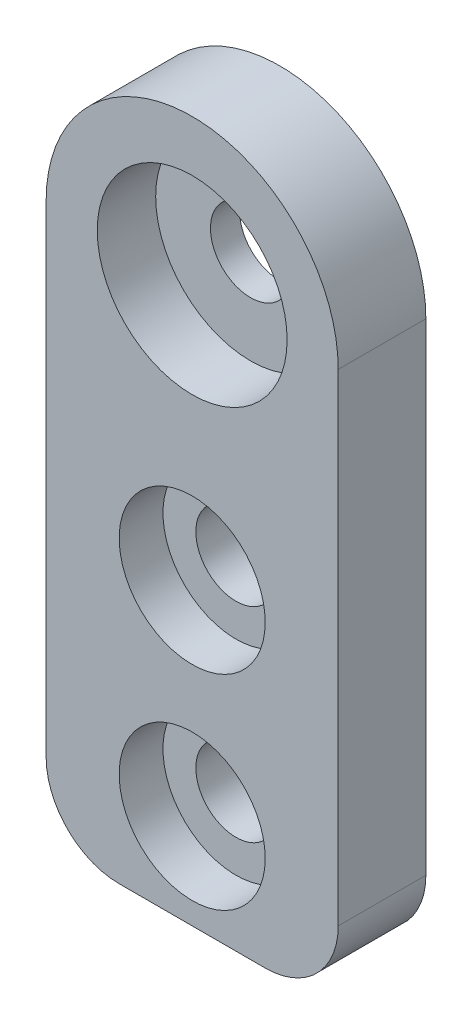
from build123d import *

# Parameters (mm, degrees)
SKETCH_2_R          = 2.75
EXTRUDE_1_DEPTH     = 6
SKETCH_3_R          = 5
CUT_EXTRUDE_1_DEPTH = 3
FILLET_1_R          = 5
SKETCH_4_R          = 6.5
CUT_EXTRUDE_2_DEPTH = 4


with BuildPart() as part:
    # Эскиз2 → Бобышка-Вытянуть1 (new body)
    with BuildSketch(Plane.XY):
        with BuildLine():
            Line((10, 19), (10, -19))
            Line((10, -19), (-10, -19))
            Line((-10, -19), (-10, 19))
            ThreePointArc((-10, 19), (0, 29), (10, 19))
        make_face()
        with Locations((0, 1.5)):
            Circle(SKETCH_2_R, mode=Mode.SUBTRACT)
        with Locations((0, -12.5)):
            Circle(SKETCH_2_R, mode=Mode.SUBTRACT)
        with Locations((0, 19)):
            Circle(SKETCH_2_R, mode=Mode.SUBTRACT)
    extrude(amount=EXTRUDE_1_DEPTH)

    # Эскиз3 → Вырез-Вытянуть1 (cut)
    with BuildSketch(Plane.XY.offset(6)):
        with Locations((0, 1.5)):
            Circle(SKETCH_3_R)
        with Locations((0, -12.5)):
            Circle(SKETCH_3_R)
    extrude(amount=-CUT_EXTRUDE_1_DEPTH, mode=Mode.SUBTRACT)

    # Скругление1
    fillet_1_edges = [part.edges().sort_by_distance(p)[0] for p in [
        (10, -19, 3),
        (-10, -19, 3),
    ]]
    fillet(fillet_1_edges, radius=FILLET_1_R)

    # Эскиз4 → Вырез-Вытянуть2 (cut)
    with BuildSketch(Plane.XY.offset(6)):
        with Locations((0, 19)):
            Circle(SKETCH_4_R)
    extrude(amount=-CUT_EXTRUDE_2_DEPTH, mode=Mode.SUBTRACT)


solid = part.part
